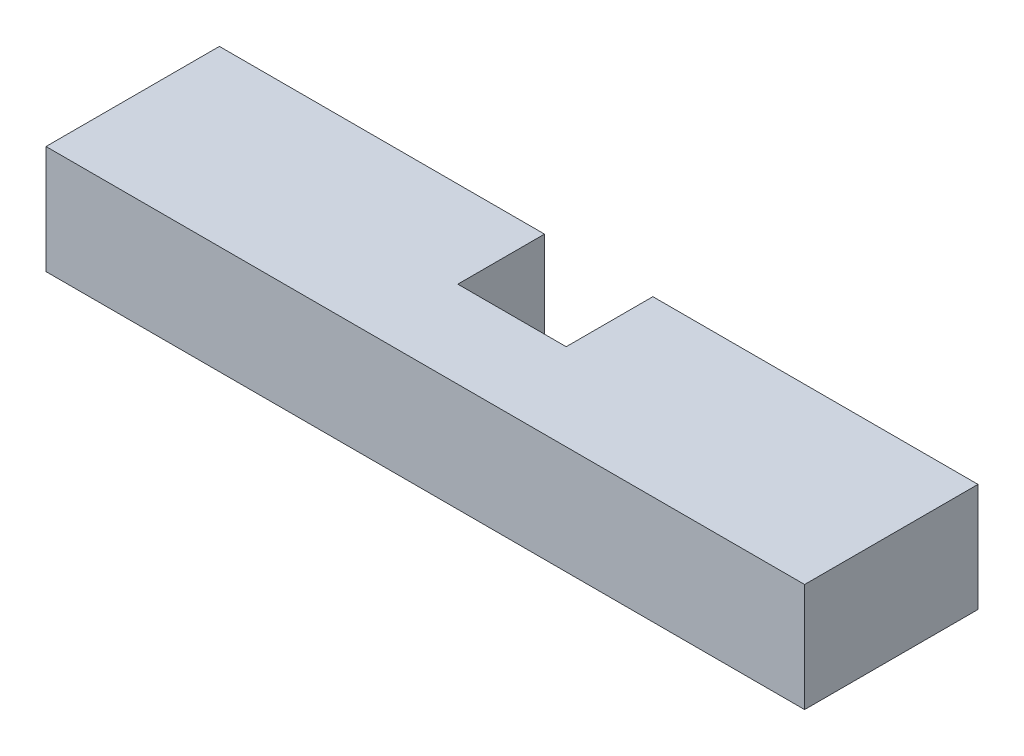
from build123d import *

# Parameters (mm, degrees)
BOSS_EXTRUDE1_DEPTH = 6.35


with BuildPart() as part:
    # Elevator Paddle Support Strut → Boss-Extrude1 (new body)
    with BuildSketch(Plane(origin=(0, 0, 0), x_dir=(1, 0, 0), z_dir=(0, 1, 0))):
        Polygon((-22.225, -5.08), (22.225, -5.08), (22.225, 5.08), (3.175, 5.08), (3.175, 0), (-3.175, 0), (-3.175, 5.08), (-22.225, 5.08), align=None)
    extrude(amount=BOSS_EXTRUDE1_DEPTH)


solid = part.part
